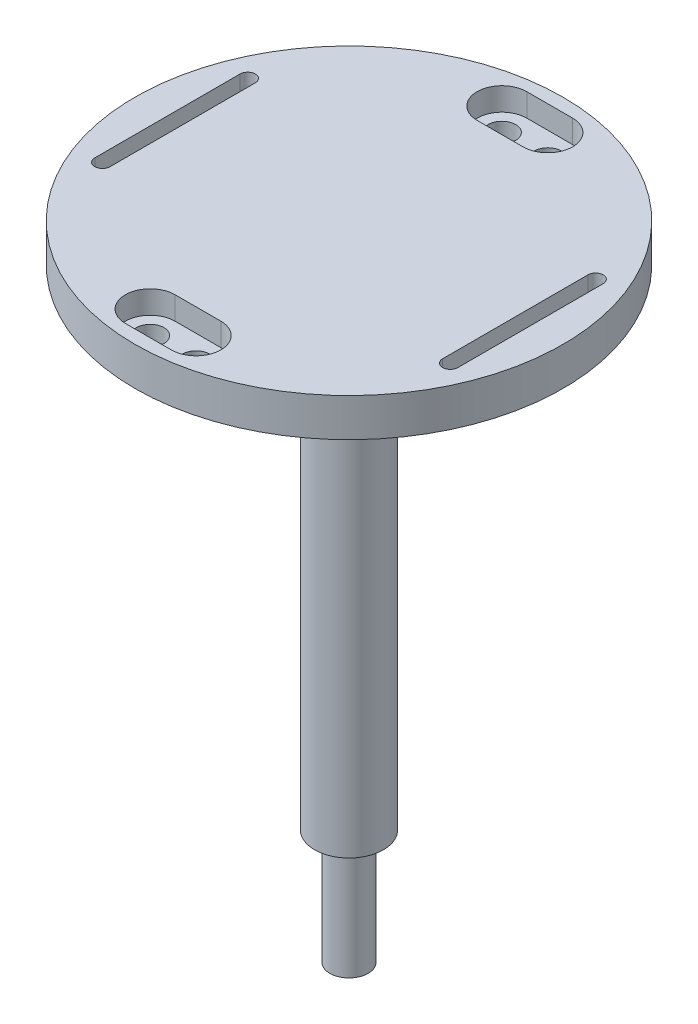
from build123d import *

# Parameters (mm, degrees)
CBORE_FOR_M3_SHCS1_D           = 3.6
CBORE_FOR_M3_SHCS1_DEPTH       = 6.500114
CBORE_FOR_M3_SHCS1_CBORE_D     = 6.5
CBORE_FOR_M3_SHCS1_CBORE_DEPTH = 3
CBORE_FOR_M3_SHCS1_TIP         = 1.081549114
CUT_EXTRUDE1_DEPTH             = 91.160967098
CUT_EXTRUDE2_DEPTH             = 93.865494063


with BuildPart() as part:
    # Sketch1 → Revolve1 (revolve)
    with BuildSketch(Plane.XY, mode=Mode.PRIVATE) as revolve1_sk:
        Polygon((0, 83.999999926), (28, 83.999999926), (28, 78.999999926), (15, 78.999999926), (15, 79.999999926), (4.5, 79.999999926), (4.5, 15), (2.5, 15), (2.5, 0), (0, 0), align=None)
    revolve(revolve1_sk.sketch.rotate(Axis((0, 0, 0), (0, 1, 0)), 90), axis=Axis((0, 0, 0), (0, 1, 0)))

    # CBORE for M3 SHCS1
    with Locations(Plane(origin=(0, 83.999999926, 0), x_dir=(1, 0, 0), z_dir=(0, 1, 0))):
        with Locations((3, 23), (-3, 23), (-3, -23), (3, -23)):
            CounterBoreHole(CBORE_FOR_M3_SHCS1_D / 2, CBORE_FOR_M3_SHCS1_CBORE_D / 2, CBORE_FOR_M3_SHCS1_CBORE_DEPTH, depth=CBORE_FOR_M3_SHCS1_DEPTH)
            with Locations((0, 0, -(CBORE_FOR_M3_SHCS1_DEPTH + CBORE_FOR_M3_SHCS1_TIP / 2))):  # 118° drill point
                Cone(0, CBORE_FOR_M3_SHCS1_D / 2, CBORE_FOR_M3_SHCS1_TIP, mode=Mode.SUBTRACT)

    # Sketch4 → Cut-Extrude1 (cut, through all)
    with BuildSketch(Plane(origin=(0, 80.999999926, 0), x_dir=(1, 0, 0), z_dir=(0, 1, 0))):
        with BuildLine():
            Line((-3, 26.25), (3, 26.25))
            ThreePointArc((3, 26.25), (6.25, 23), (3, 19.75))
            Line((3, 19.75), (-3, 19.75))
            ThreePointArc((-3, 19.75), (-6.25, 23), (-3, 26.25))
        make_face()
        with BuildLine():
            Line((-3, -19.75), (3, -19.75))
            ThreePointArc((3, -19.75), (6.25, -23), (3, -26.25))
            Line((3, -26.25), (-3, -26.25))
            ThreePointArc((-3, -26.25), (-6.25, -23), (-3, -19.75))
        make_face()
    extrude(amount=CUT_EXTRUDE1_DEPTH, mode=Mode.SUBTRACT)

    # Sketch5 → Cut-Extrude2 (cut, through all)
    with BuildSketch(Plane(origin=(0, 83.999999926, 0), x_dir=(1, 0, 0), z_dir=(0, 1, 0))):
        with BuildLine():
            Line((-23.75, -9.5), (-23.75, 9.5))
            ThreePointArc((-23.75, 9.5), (-22.75, 10.5), (-21.75, 9.5))
            Line((-21.75, 9.5), (-21.75, -9.5))
            ThreePointArc((-21.75, -9.5), (-22.75, -10.5), (-23.75, -9.5))
        make_face()
    cut_extrude2 = extrude(amount=-CUT_EXTRUDE2_DEPTH, mode=Mode.SUBTRACT)

    # Mirror1: Cut-Extrude2 across plane
    add(cut_extrude2.mirror(Plane(origin=(0, 0, 0), x_dir=(0, 0, 1), z_dir=(1, 0, 0))), mode=Mode.SUBTRACT)


solid = part.part
